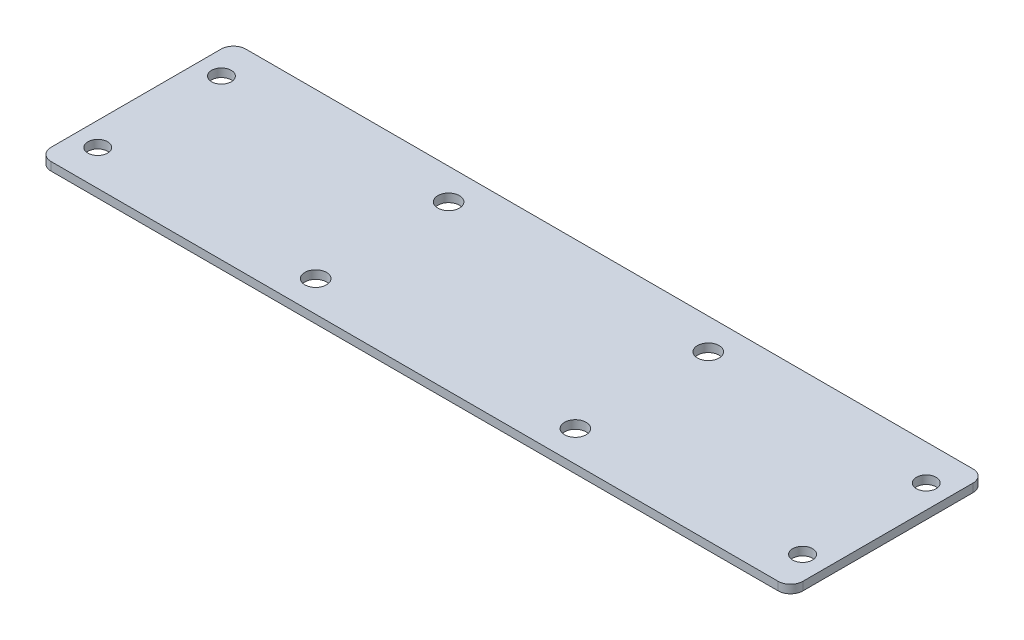
from build123d import *

# Parameters (mm, degrees)
SKETCH2_W           = 121.6
SKETCH2_H           = 31.5
SKETCH2_R           = 1.6
BOSS_EXTRUDE1_DEPTH = 1.35
FILLET1_R           = 2
SKETCH3_R           = 1.75
CUT_EXTRUDE1_DEPTH  = 63.821373751


with BuildPart() as part:
    # Sketch2 → Boss-Extrude1 (new body)
    with BuildSketch(Plane(origin=(0, 0, 0), x_dir=(1, 0, 0), z_dir=(0, 1, 0))):
        Rectangle(SKETCH2_W, SKETCH2_H)
        with Locations(Location((-57, 10, 0), (0, 0, 270))):
            Circle(SKETCH2_R, mode=Mode.SUBTRACT)
        with Locations(Location((-57, -10, 0), (0, 0, 270))):
            Circle(SKETCH2_R, mode=Mode.SUBTRACT)
        with Locations(Location((57, 10, 0), (0, 0, 270))):
            Circle(SKETCH2_R, mode=Mode.SUBTRACT)
        with Locations(Location((57, -10, 0), (0, 0, 270))):
            Circle(SKETCH2_R, mode=Mode.SUBTRACT)
    extrude(amount=-BOSS_EXTRUDE1_DEPTH)

    # Fillet1
    fillet1_edges = [part.edges().sort_by_distance(p)[0] for p in [
        (-60.8, -0.675, -15.75),
        (60.8, -0.675, -15.75),
        (60.8, -0.675, 15.75),
        (-60.8, -0.675, 15.75),
    ]]
    fillet(fillet1_edges, radius=FILLET1_R)

    # Sketch3 → Cut-Extrude1 (cut, through all)
    with BuildSketch(Plane(origin=(0, 0, 0), x_dir=(1, 0, 0), z_dir=(0, 1, 0))):
        with Locations(Location((-21, -10.75, 0), (0, 0, 270))):
            Circle(SKETCH3_R)
        with Locations(Location((21, -10.75, 0), (0, 0, 270))):
            Circle(SKETCH3_R)
        with Locations(Location((21, 10.75, 0), (0, 0, 270))):
            Circle(SKETCH3_R)
        with Locations(Location((-21, 10.75, 0), (0, 0, 270))):
            Circle(SKETCH3_R)
    extrude(amount=-CUT_EXTRUDE1_DEPTH, mode=Mode.SUBTRACT)


solid = part.part
